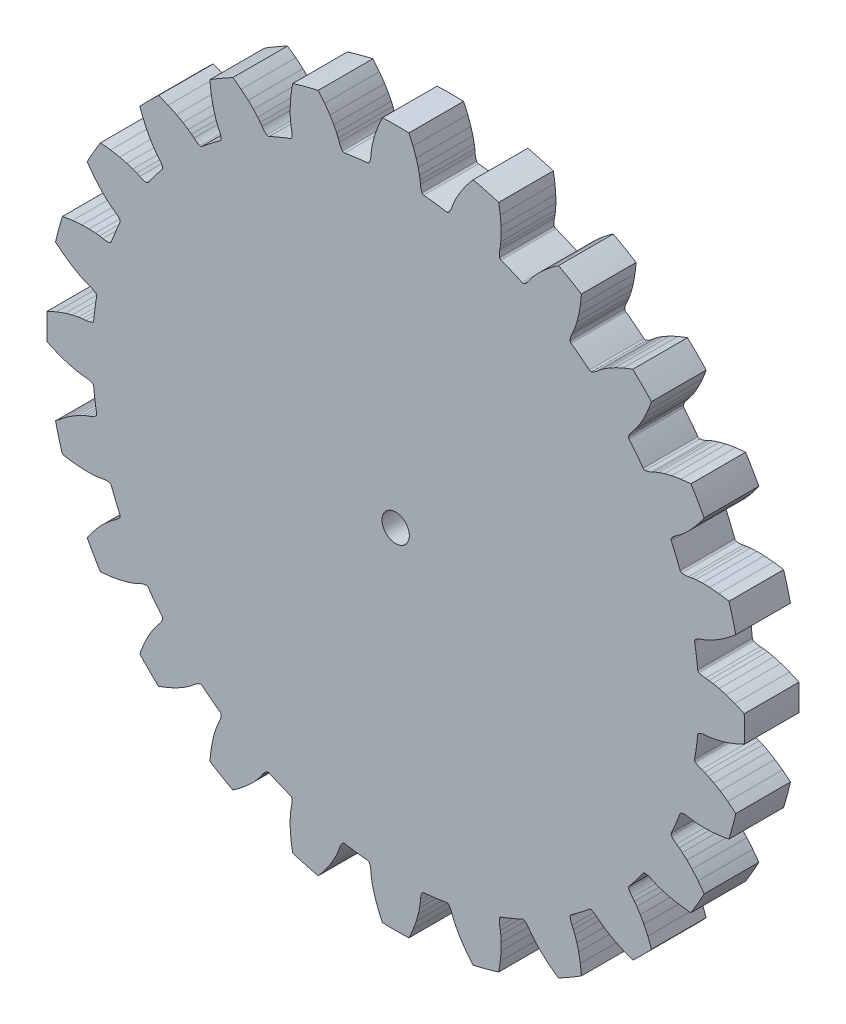
from build123d import *

# Parameters (mm, degrees)
BOSS_EXTRUDE1_DEPTH = 6.35
SKETCH2_R           = 1.5875
CUT_EXTRUDE1_DEPTH  = 58.632651032


with BuildPart() as part:
    # Model → Boss-Extrude1 (new body)
    with BuildSketch(Plane.XY):
        with BuildLine():
            ThreePointArc((34.918122358, -4.597058019), (34.999024317, -3.934019352), (35.067337394, -3.269565647))
            ThreePointArc((35.067337394, -3.269565647), (35.117289307, -3.136889034), (35.227836474, -3.048133181))
            ThreePointArc((35.227836474, -3.048133181), (35.597586296, -2.925959175), (35.983262257, -2.872149586))
            ThreePointArc((35.983262257, -2.872149586), (36.173696873, -2.859616768), (36.363582299, -2.840487209))
            ThreePointArc((36.363582299, -2.840487209), (36.599053851, -2.809299698), (36.833565008, -2.771563378))
            ThreePointArc((36.833565008, -2.771563378), (37.195949989, -2.701153106), (37.555494844, -2.617439436))
            ThreePointArc((37.555494844, -2.617439436), (37.966482977, -2.506715419), (38.373723351, -2.382915857))
            ThreePointArc((38.373723351, -2.382915857), (38.883469202, -2.208794801), (39.386594794, -2.016379586))
            ThreePointArc((39.386594794, -2.016379586), (39.934832511, -1.784794144), (40.475208291, -1.535414057))
            ThreePointArc((40.475208291, -1.535414057), (40.504320541, 0), (40.475208291, 1.535414057))
            ThreePointArc((40.475208291, 1.535414057), (39.934832515, 1.784794142), (39.386594803, 2.016379583))
            ThreePointArc((39.386594803, 2.016379583), (38.883469215, 2.208794797), (38.373723367, 2.382915852))
            ThreePointArc((38.373723367, 2.382915852), (37.966482996, 2.506715414), (37.555494865, 2.617439431))
            ThreePointArc((37.555494865, 2.617439431), (37.195950011, 2.701153102), (36.83356503, 2.771563374))
            ThreePointArc((36.83356503, 2.771563374), (36.599053872, 2.809299694), (36.363582319, 2.840487206))
            ThreePointArc((36.363582319, 2.840487206), (36.173696892, 2.859616766), (35.983262273, 2.872149585))
            ThreePointArc((35.983262273, 2.872149585), (35.597586321, 2.925959167), (35.227836504, 3.048133159))
            ThreePointArc((35.227836504, 3.048133159), (35.117289331, 3.136889003), (35.067337397, 3.269565608))
            ThreePointArc((35.067337397, 3.269565608), (34.91812236, 4.597058), (34.718672707, 5.917936879))
            ThreePointArc((34.718672707, 5.917936879), (34.732583315, 6.059021153), (34.816391973, 6.173364435))
            ThreePointArc((34.816391973, 6.173364435), (35.141921916, 6.38707376), (35.500529341, 6.538870115))
            ThreePointArc((35.500529341, 6.538870115), (35.681231323, 6.600263994), (35.859695466, 6.667887693))
            ThreePointArc((35.859695466, 6.667887693), (36.079071597, 6.758957038), (36.295825102, 6.856103477))
            ThreePointArc((36.295825102, 6.856103477), (36.627638596, 7.017906712), (36.953265565, 7.191824964))
            ThreePointArc((36.953265565, 7.191824964), (37.321592132, 7.405147707), (37.682914442, 7.630130466))
            ThreePointArc((37.682914442, 7.630130466), (38.13022528, 7.930250426), (38.56640656, 8.246327736))
            ThreePointArc((38.56640656, 8.246327736), (39.036024807, 8.611916458), (39.493443412, 8.992658669))
            ThreePointArc((39.493443412, 8.992658669), (39.124169287, 10.483289565), (38.698654612, 11.958850852))
            ThreePointArc((38.698654612, 11.958850852), (38.112147379, 12.059873974), (37.522651691, 12.141673971))
            ThreePointArc((37.522651691, 12.141673971), (36.986868971, 12.197314312), (36.449426446, 12.233570402))
            ThreePointArc((36.449426446, 12.233570402), (36.024020769, 12.247750032), (35.598379235, 12.248329665))
            ThreePointArc((35.598379235, 12.248329665), (35.229418882, 12.236133805), (34.861158351, 12.210352771))
            ThreePointArc((34.861158351, 12.210352771), (34.624871089, 12.186107303), (34.389351112, 12.155287604))
            ThreePointArc((34.389351112, 12.155287604), (34.20098478, 12.124619375), (34.013795331, 12.087437043))
            ThreePointArc((34.013795331, 12.087437043), (33.627334023, 12.039592826), (33.23856217, 12.061905546))
            ThreePointArc((33.23856217, 12.061905546), (33.108810098, 12.119025393), (33.026221003, 12.234252641))
            ThreePointArc((33.026221003, 12.234252641), (32.538510031, 13.477892133), (32.00398785, 14.702141787))
            ThreePointArc((32.00398785, 14.702141787), (31.980909169, 14.842019062), (32.032267897, 14.974157468))
            ThreePointArc((32.032267897, 14.974157468), (32.291393633, 15.264838172), (32.598494018, 15.504276623))
            ThreePointArc((32.598494018, 15.504276623), (32.757148825, 15.610347671), (32.912029648, 15.721857067))
            ThreePointArc((32.912029648, 15.721857067), (33.100360238, 15.86660202), (33.284584698, 16.01653821))
            ThreePointArc((33.284584698, 16.01653821), (33.563214162, 16.258707785), (33.832732305, 16.510978377))
            ThreePointArc((33.832732305, 16.510978377), (34.13329646, 16.812362255), (34.424077188, 17.123196008))
            ThreePointArc((34.424077188, 17.123196008), (34.778469517, 17.528862191), (35.117981453, 17.947061451))
            ThreePointArc((35.117981453, 17.947061451), (35.476976522, 18.421739186), (35.820265632, 18.907896567))
            ThreePointArc((35.820265632, 18.907896567), (35.077770552, 20.252160271), (34.284851575, 21.567311724))
            ThreePointArc((34.284851575, 21.567311724), (33.692182383, 21.513093325), (33.101601876, 21.439533344))
            ThreePointArc((33.101601876, 21.439533344), (32.569674729, 21.354607013), (32.041161348, 21.250527346))
            ThreePointArc((32.041161348, 21.250527346), (31.62658106, 21.154120727), (31.215292889, 21.044516473))
            ThreePointArc((31.215292889, 21.044516473), (30.862061076, 20.937242211), (30.513021341, 20.817026805))
            ThreePointArc((30.513021341, 20.817026805), (30.291060561, 20.732451838), (30.071542458, 20.64172524))
            ThreePointArc((30.071542458, 20.64172524), (29.897532074, 20.56334921), (29.726344447, 20.478985641))
            ThreePointArc((29.726344447, 20.478985641), (29.365434484, 20.33274813), (28.984134754, 20.253679002))
            ThreePointArc((28.984134754, 20.253679002), (28.844020171, 20.275270231), (28.734422225, 20.365195575))
            ThreePointArc((28.734422225, 20.365195575), (27.941452016, 21.440230191), (27.10828411, 22.484420029))
            ThreePointArc((27.10828411, 22.484420029), (27.049788913, 22.613557898), (27.065197699, 22.754486415))
            ThreePointArc((27.065197699, 22.754486415), (27.240260237, 23.10232909), (27.4749252, 23.413092302))
            ThreePointArc((27.4749252, 23.413092302), (27.600720768, 23.556611952), (27.721463399, 23.704407864))
            ThreePointArc((27.721463399, 23.704407864), (27.865914029, 23.892964296), (28.005054851, 24.085472333))
            ThreePointArc((28.005054851, 24.085472333), (28.211512149, 24.391504792), (28.40655425, 24.7049359))
            ThreePointArc((28.40655425, 24.7049359), (28.618873042, 25.073842099), (28.819295962, 25.449344039))
            ThreePointArc((28.819295962, 25.449344039), (29.056618531, 25.932910967), (29.276323945, 26.424732587))
            ThreePointArc((29.276323945, 26.424732587), (29.500230916, 26.976150832), (29.705995944, 27.534592561))
            ThreePointArc((29.705995944, 27.534592561), (28.640879722, 28.640879722), (27.534592561, 29.705995944))
            ThreePointArc((27.534592561, 29.705995944), (26.976150836, 29.500230918), (26.424732596, 29.276323949))
            ThreePointArc((26.424732596, 29.276323949), (25.932910979, 29.056618537), (25.449344054, 28.81929597))
            ThreePointArc((25.449344054, 28.81929597), (25.073842116, 28.618873052), (24.704935918, 28.406554261))
            ThreePointArc((24.704935918, 28.406554261), (24.39150481, 28.211512161), (24.085472352, 28.005054864))
            ThreePointArc((24.085472352, 28.005054864), (23.892964314, 27.865914042), (23.704407881, 27.721463412))
            ThreePointArc((23.704407881, 27.721463412), (23.556611966, 27.60072078), (23.413092315, 27.474925211))
            ThreePointArc((23.413092315, 27.474925211), (23.102329113, 27.24026025), (22.754486452, 27.065197706))
            ThreePointArc((22.754486452, 27.065197706), (22.613557937, 27.049788908), (22.484420059, 27.108284085))
            ThreePointArc((22.484420059, 27.108284085), (21.440230222, 27.941451993), (20.365195606, 28.734422203))
            ThreePointArc((20.365195606, 28.734422203), (20.275270245, 28.844020135), (20.253679006, 28.984134716))
            ThreePointArc((20.253679006, 28.984134716), (20.332748124, 29.365434458), (20.478985633, 29.726344432))
            ThreePointArc((20.478985633, 29.726344432), (20.563349202, 29.897532057), (20.641725231, 30.071542439))
            ThreePointArc((20.641725231, 30.071542439), (20.73245183, 30.29106054), (20.817026797, 30.51302132))
            ThreePointArc((20.817026797, 30.51302132), (20.937242204, 30.862061055), (21.044516467, 31.215292869))
            ThreePointArc((21.044516467, 31.215292869), (21.154120722, 31.626581041), (21.250527343, 32.041161331))
            ThreePointArc((21.250527343, 32.041161331), (21.354607011, 32.569674716), (21.439533342, 33.101601867))
            ThreePointArc((21.439533342, 33.101601867), (21.513093325, 33.692182378), (21.567311724, 34.284851575))
            ThreePointArc((21.567311724, 34.284851575), (20.252160271, 35.077770552), (18.907896567, 35.820265632))
            ThreePointArc((18.907896567, 35.820265632), (18.42173919, 35.476976525), (17.947061459, 35.117981459))
            ThreePointArc((17.947061459, 35.117981459), (17.528862202, 34.778469526), (17.123196021, 34.4240772))
            ThreePointArc((17.123196021, 34.4240772), (16.812362269, 34.133296474), (16.510978392, 33.83273232))
            ThreePointArc((16.510978392, 33.83273232), (16.2587078, 33.563214178), (16.016538225, 33.284584715))
            ThreePointArc((16.016538225, 33.284584715), (15.866602034, 33.100360255), (15.72185708, 32.912029664))
            ThreePointArc((15.72185708, 32.912029664), (15.610347682, 32.75714884), (15.504276633, 32.598494032))
            ThreePointArc((15.504276633, 32.598494032), (15.264838191, 32.291393651), (14.974157502, 32.032267913))
            ThreePointArc((14.974157502, 32.032267913), (14.8420191, 31.980909174), (14.702141823, 32.003987833))
            ThreePointArc((14.702141823, 32.003987833), (13.477892169, 32.538510016), (12.234252678, 33.026220989))
            ThreePointArc((12.234252678, 33.026220989), (12.119025417, 33.108810067), (12.061905559, 33.238562135))
            ThreePointArc((12.061905559, 33.238562135), (12.039592826, 33.627333997), (12.087437039, 34.013795315))
            ThreePointArc((12.087437039, 34.013795315), (12.124619372, 34.200984761), (12.155287601, 34.389351092))
            ThreePointArc((12.155287601, 34.389351092), (12.186107301, 34.624871067), (12.210352769, 34.861158328))
            ThreePointArc((12.210352769, 34.861158328), (12.236133804, 35.22941886), (12.248329664, 35.598379214))
            ThreePointArc((12.248329664, 35.598379214), (12.247750033, 36.02402075), (12.233570403, 36.449426428))
            ThreePointArc((12.233570403, 36.449426428), (12.197314313, 36.986868957), (12.141673972, 37.522651682))
            ThreePointArc((12.141673972, 37.522651682), (12.059873975, 38.112147374), (11.958850852, 38.698654612))
            ThreePointArc((11.958850852, 38.698654612), (10.483289565, 39.124169287), (8.992658669, 39.493443412))
            ThreePointArc((8.992658669, 39.493443412), (8.611916461, 39.03602481), (8.246327742, 38.566406568))
            ThreePointArc((8.246327742, 38.566406568), (7.930250433, 38.130225291), (7.630130476, 37.682914457))
            ThreePointArc((7.630130476, 37.682914457), (7.405147717, 37.321592149), (7.191824974, 36.953265583))
            ThreePointArc((7.191824974, 36.953265583), (7.017906722, 36.627638615), (6.856103487, 36.295825123))
            ThreePointArc((6.856103487, 36.295825123), (6.758957046, 36.079071617), (6.6678877, 35.859695485))
            ThreePointArc((6.6678877, 35.859695485), (6.600264, 35.681231341), (6.53887012, 35.500529357))
            ThreePointArc((6.53887012, 35.500529357), (6.387073773, 35.141921939), (6.173364465, 34.816391997))
            ThreePointArc((6.173364465, 34.816391997), (6.059021189, 34.73258333), (5.917936918, 34.7186727))
            ThreePointArc((5.917936918, 34.7186727), (4.597058039, 34.918122355), (3.269565647, 35.067337394))
            ThreePointArc((3.269565647, 35.067337394), (3.136889034, 35.117289307), (3.048133181, 35.227836474))
            ThreePointArc((3.048133181, 35.227836474), (2.925959175, 35.597586296), (2.872149586, 35.983262257))
            ThreePointArc((2.872149586, 35.983262257), (2.859616768, 36.173696873), (2.840487209, 36.363582299))
            ThreePointArc((2.840487209, 36.363582299), (2.809299698, 36.599053851), (2.771563378, 36.833565008))
            ThreePointArc((2.771563378, 36.833565008), (2.701153106, 37.195949989), (2.617439436, 37.555494844))
            ThreePointArc((2.617439436, 37.555494844), (2.506715419, 37.966482977), (2.382915857, 38.373723351))
            ThreePointArc((2.382915857, 38.373723351), (2.208794801, 38.883469202), (2.016379586, 39.386594794))
            ThreePointArc((2.016379586, 39.386594794), (1.784794144, 39.934832511), (1.535414057, 40.475208291))
            ThreePointArc((1.535414057, 40.475208291), (0, 40.504320541), (-1.535414057, 40.475208291))
            ThreePointArc((-1.535414057, 40.475208291), (-1.784794142, 39.934832515), (-2.016379583, 39.386594803))
            ThreePointArc((-2.016379583, 39.386594803), (-2.208794797, 38.883469215), (-2.382915852, 38.373723367))
            ThreePointArc((-2.382915852, 38.373723367), (-2.506715414, 37.966482996), (-2.617439431, 37.555494865))
            ThreePointArc((-2.617439431, 37.555494865), (-2.701153102, 37.195950011), (-2.771563374, 36.83356503))
            ThreePointArc((-2.771563374, 36.83356503), (-2.809299694, 36.599053872), (-2.840487206, 36.363582319))
            ThreePointArc((-2.840487206, 36.363582319), (-2.859616766, 36.173696892), (-2.872149585, 35.983262273))
            ThreePointArc((-2.872149585, 35.983262273), (-2.925959167, 35.597586321), (-3.048133159, 35.227836504))
            ThreePointArc((-3.048133159, 35.227836504), (-3.136889003, 35.117289331), (-3.269565608, 35.067337397))
            ThreePointArc((-3.269565608, 35.067337397), (-4.597058, 34.91812236), (-5.917936879, 34.718672707))
            ThreePointArc((-5.917936879, 34.718672707), (-6.059021153, 34.732583315), (-6.173364435, 34.816391973))
            ThreePointArc((-6.173364435, 34.816391973), (-6.38707376, 35.141921916), (-6.538870115, 35.500529341))
            ThreePointArc((-6.538870115, 35.500529341), (-6.600263994, 35.681231323), (-6.667887693, 35.859695466))
            ThreePointArc((-6.667887693, 35.859695466), (-6.758957038, 36.079071597), (-6.856103477, 36.295825102))
            ThreePointArc((-6.856103477, 36.295825102), (-7.017906712, 36.627638596), (-7.191824964, 36.953265565))
            ThreePointArc((-7.191824964, 36.953265565), (-7.405147707, 37.321592132), (-7.630130466, 37.682914442))
            ThreePointArc((-7.630130466, 37.682914442), (-7.930250426, 38.13022528), (-8.246327736, 38.56640656))
            ThreePointArc((-8.246327736, 38.56640656), (-8.611916458, 39.036024807), (-8.992658669, 39.493443412))
            ThreePointArc((-8.992658669, 39.493443412), (-10.483289565, 39.124169287), (-11.958850852, 38.698654612))
            ThreePointArc((-11.958850852, 38.698654612), (-12.059873974, 38.112147379), (-12.141673971, 37.522651691))
            ThreePointArc((-12.141673971, 37.522651691), (-12.197314312, 36.986868971), (-12.233570402, 36.449426446))
            ThreePointArc((-12.233570402, 36.449426446), (-12.247750032, 36.024020769), (-12.248329665, 35.598379235))
            ThreePointArc((-12.248329665, 35.598379235), (-12.236133805, 35.229418882), (-12.210352771, 34.861158351))
            ThreePointArc((-12.210352771, 34.861158351), (-12.186107303, 34.624871089), (-12.155287604, 34.389351112))
            ThreePointArc((-12.155287604, 34.389351112), (-12.124619375, 34.20098478), (-12.087437043, 34.013795331))
            ThreePointArc((-12.087437043, 34.013795331), (-12.039592826, 33.627334023), (-12.061905546, 33.23856217))
            ThreePointArc((-12.061905546, 33.23856217), (-12.119025393, 33.108810098), (-12.234252641, 33.026221003))
            ThreePointArc((-12.234252641, 33.026221003), (-13.477892133, 32.538510031), (-14.702141787, 32.00398785))
            ThreePointArc((-14.702141787, 32.00398785), (-14.842019062, 31.980909169), (-14.974157468, 32.032267897))
            ThreePointArc((-14.974157468, 32.032267897), (-15.264838172, 32.291393633), (-15.504276623, 32.598494018))
            ThreePointArc((-15.504276623, 32.598494018), (-15.610347671, 32.757148825), (-15.721857067, 32.912029648))
            ThreePointArc((-15.721857067, 32.912029648), (-15.86660202, 33.100360238), (-16.01653821, 33.284584698))
            ThreePointArc((-16.01653821, 33.284584698), (-16.258707785, 33.563214162), (-16.510978377, 33.832732305))
            ThreePointArc((-16.510978377, 33.832732305), (-16.812362255, 34.13329646), (-17.123196008, 34.424077188))
            ThreePointArc((-17.123196008, 34.424077188), (-17.528862191, 34.778469517), (-17.947061451, 35.117981453))
            ThreePointArc((-17.947061451, 35.117981453), (-18.421739186, 35.476976522), (-18.907896567, 35.820265632))
            ThreePointArc((-18.907896567, 35.820265632), (-20.252160271, 35.077770552), (-21.567311724, 34.284851575))
            ThreePointArc((-21.567311724, 34.284851575), (-21.513093325, 33.692182383), (-21.439533344, 33.101601876))
            ThreePointArc((-21.439533344, 33.101601876), (-21.354607013, 32.569674729), (-21.250527346, 32.041161348))
            ThreePointArc((-21.250527346, 32.041161348), (-21.154120727, 31.62658106), (-21.044516473, 31.215292889))
            ThreePointArc((-21.044516473, 31.215292889), (-20.937242211, 30.862061076), (-20.817026805, 30.513021341))
            ThreePointArc((-20.817026805, 30.513021341), (-20.732451838, 30.291060561), (-20.64172524, 30.071542458))
            ThreePointArc((-20.64172524, 30.071542458), (-20.56334921, 29.897532074), (-20.478985641, 29.726344447))
            ThreePointArc((-20.478985641, 29.726344447), (-20.33274813, 29.365434484), (-20.253679002, 28.984134754))
            ThreePointArc((-20.253679002, 28.984134754), (-20.275270231, 28.844020171), (-20.365195575, 28.734422225))
            ThreePointArc((-20.365195575, 28.734422225), (-21.440230191, 27.941452016), (-22.484420029, 27.10828411))
            ThreePointArc((-22.484420029, 27.10828411), (-22.613557898, 27.049788913), (-22.754486415, 27.065197699))
            ThreePointArc((-22.754486415, 27.065197699), (-23.10232909, 27.240260237), (-23.413092302, 27.4749252))
            ThreePointArc((-23.413092302, 27.4749252), (-23.556611952, 27.600720768), (-23.704407864, 27.721463399))
            ThreePointArc((-23.704407864, 27.721463399), (-23.892964296, 27.865914029), (-24.085472333, 28.005054851))
            ThreePointArc((-24.085472333, 28.005054851), (-24.391504792, 28.211512149), (-24.7049359, 28.40655425))
            ThreePointArc((-24.7049359, 28.40655425), (-25.073842099, 28.618873042), (-25.449344039, 28.819295962))
            ThreePointArc((-25.449344039, 28.819295962), (-25.932910967, 29.056618531), (-26.424732587, 29.276323945))
            ThreePointArc((-26.424732587, 29.276323945), (-26.976150832, 29.500230916), (-27.534592561, 29.705995944))
            ThreePointArc((-27.534592561, 29.705995944), (-28.640879722, 28.640879722), (-29.705995944, 27.534592561))
            ThreePointArc((-29.705995944, 27.534592561), (-29.500230918, 26.976150836), (-29.276323949, 26.424732596))
            ThreePointArc((-29.276323949, 26.424732596), (-29.056618537, 25.932910979), (-28.81929597, 25.449344054))
            ThreePointArc((-28.81929597, 25.449344054), (-28.618873052, 25.073842116), (-28.406554261, 24.704935918))
            ThreePointArc((-28.406554261, 24.704935918), (-28.211512161, 24.39150481), (-28.005054864, 24.085472352))
            ThreePointArc((-28.005054864, 24.085472352), (-27.865914042, 23.892964314), (-27.721463412, 23.704407881))
            ThreePointArc((-27.721463412, 23.704407881), (-27.60072078, 23.556611966), (-27.474925211, 23.413092315))
            ThreePointArc((-27.474925211, 23.413092315), (-27.24026025, 23.102329113), (-27.065197706, 22.754486452))
            ThreePointArc((-27.065197706, 22.754486452), (-27.049788908, 22.613557937), (-27.108284085, 22.484420059))
            ThreePointArc((-27.108284085, 22.484420059), (-27.941451993, 21.440230222), (-28.734422203, 20.365195606))
            ThreePointArc((-28.734422203, 20.365195606), (-28.844020135, 20.275270245), (-28.984134716, 20.253679006))
            ThreePointArc((-28.984134716, 20.253679006), (-29.365434458, 20.332748124), (-29.726344432, 20.478985633))
            ThreePointArc((-29.726344432, 20.478985633), (-29.897532057, 20.563349202), (-30.071542439, 20.641725231))
            ThreePointArc((-30.071542439, 20.641725231), (-30.29106054, 20.73245183), (-30.51302132, 20.817026797))
            ThreePointArc((-30.51302132, 20.817026797), (-30.862061055, 20.937242204), (-31.215292869, 21.044516467))
            ThreePointArc((-31.215292869, 21.044516467), (-31.626581041, 21.154120722), (-32.041161331, 21.250527343))
            ThreePointArc((-32.041161331, 21.250527343), (-32.569674716, 21.354607011), (-33.101601867, 21.439533342))
            ThreePointArc((-33.101601867, 21.439533342), (-33.692182378, 21.513093325), (-34.284851575, 21.567311724))
            ThreePointArc((-34.284851575, 21.567311724), (-35.077770552, 20.252160271), (-35.820265632, 18.907896567))
            ThreePointArc((-35.820265632, 18.907896567), (-35.476976525, 18.42173919), (-35.117981459, 17.947061459))
            ThreePointArc((-35.117981459, 17.947061459), (-34.778469526, 17.528862202), (-34.4240772, 17.123196021))
            ThreePointArc((-34.4240772, 17.123196021), (-34.133296474, 16.812362269), (-33.83273232, 16.510978392))
            ThreePointArc((-33.83273232, 16.510978392), (-33.563214178, 16.2587078), (-33.284584715, 16.016538225))
            ThreePointArc((-33.284584715, 16.016538225), (-33.100360255, 15.866602034), (-32.912029664, 15.72185708))
            ThreePointArc((-32.912029664, 15.72185708), (-32.75714884, 15.610347682), (-32.598494032, 15.504276633))
            ThreePointArc((-32.598494032, 15.504276633), (-32.291393651, 15.264838191), (-32.032267913, 14.974157502))
            ThreePointArc((-32.032267913, 14.974157502), (-31.980909174, 14.8420191), (-32.003987833, 14.702141823))
            ThreePointArc((-32.003987833, 14.702141823), (-32.538510016, 13.477892169), (-33.026220989, 12.234252678))
            ThreePointArc((-33.026220989, 12.234252678), (-33.108810067, 12.119025417), (-33.238562135, 12.061905559))
            ThreePointArc((-33.238562135, 12.061905559), (-33.627333997, 12.039592826), (-34.013795315, 12.087437039))
            ThreePointArc((-34.013795315, 12.087437039), (-34.200984761, 12.124619372), (-34.389351092, 12.155287601))
            ThreePointArc((-34.389351092, 12.155287601), (-34.624871067, 12.186107301), (-34.861158328, 12.210352769))
            ThreePointArc((-34.861158328, 12.210352769), (-35.22941886, 12.236133804), (-35.598379214, 12.248329664))
            ThreePointArc((-35.598379214, 12.248329664), (-36.02402075, 12.247750033), (-36.449426428, 12.233570403))
            ThreePointArc((-36.449426428, 12.233570403), (-36.986868957, 12.197314313), (-37.522651682, 12.141673972))
            ThreePointArc((-37.522651682, 12.141673972), (-38.112147374, 12.059873975), (-38.698654612, 11.958850852))
            ThreePointArc((-38.698654612, 11.958850852), (-39.124169287, 10.483289565), (-39.493443412, 8.992658669))
            ThreePointArc((-39.493443412, 8.992658669), (-39.03602481, 8.611916461), (-38.566406568, 8.246327742))
            ThreePointArc((-38.566406568, 8.246327742), (-38.130225291, 7.930250433), (-37.682914457, 7.630130476))
            ThreePointArc((-37.682914457, 7.630130476), (-37.321592149, 7.405147717), (-36.953265583, 7.191824974))
            ThreePointArc((-36.953265583, 7.191824974), (-36.627638615, 7.017906722), (-36.295825123, 6.856103487))
            ThreePointArc((-36.295825123, 6.856103487), (-36.079071617, 6.758957046), (-35.859695485, 6.6678877))
            ThreePointArc((-35.859695485, 6.6678877), (-35.681231341, 6.600264), (-35.500529357, 6.53887012))
            ThreePointArc((-35.500529357, 6.53887012), (-35.141921939, 6.387073773), (-34.816391997, 6.173364465))
            ThreePointArc((-34.816391997, 6.173364465), (-34.73258333, 6.059021189), (-34.7186727, 5.917936918))
            ThreePointArc((-34.7186727, 5.917936918), (-34.918122355, 4.597058039), (-35.067337394, 3.269565647))
            ThreePointArc((-35.067337394, 3.269565647), (-35.117289307, 3.136889034), (-35.227836474, 3.048133181))
            ThreePointArc((-35.227836474, 3.048133181), (-35.597586296, 2.925959175), (-35.983262257, 2.872149586))
            ThreePointArc((-35.983262257, 2.872149586), (-36.173696873, 2.859616768), (-36.363582299, 2.840487209))
            ThreePointArc((-36.363582299, 2.840487209), (-36.599053851, 2.809299698), (-36.833565008, 2.771563378))
            ThreePointArc((-36.833565008, 2.771563378), (-37.195949989, 2.701153106), (-37.555494844, 2.617439436))
            ThreePointArc((-37.555494844, 2.617439436), (-37.966482977, 2.506715419), (-38.373723351, 2.382915857))
            ThreePointArc((-38.373723351, 2.382915857), (-38.883469202, 2.208794801), (-39.386594794, 2.016379586))
            ThreePointArc((-39.386594794, 2.016379586), (-39.934832511, 1.784794144), (-40.475208291, 1.535414057))
            ThreePointArc((-40.475208291, 1.535414057), (-40.504320541, 0), (-40.475208291, -1.535414057))
            ThreePointArc((-40.475208291, -1.535414057), (-39.934832515, -1.784794142), (-39.386594803, -2.016379583))
            ThreePointArc((-39.386594803, -2.016379583), (-38.883469215, -2.208794797), (-38.373723367, -2.382915852))
            ThreePointArc((-38.373723367, -2.382915852), (-37.966482996, -2.506715414), (-37.555494865, -2.617439431))
            ThreePointArc((-37.555494865, -2.617439431), (-37.195950011, -2.701153102), (-36.83356503, -2.771563374))
            ThreePointArc((-36.83356503, -2.771563374), (-36.599053872, -2.809299694), (-36.363582319, -2.840487206))
            ThreePointArc((-36.363582319, -2.840487206), (-36.173696892, -2.859616766), (-35.983262273, -2.872149585))
            ThreePointArc((-35.983262273, -2.872149585), (-35.597586321, -2.925959167), (-35.227836504, -3.048133159))
            ThreePointArc((-35.227836504, -3.048133159), (-35.117289331, -3.136889003), (-35.067337397, -3.269565608))
            ThreePointArc((-35.067337397, -3.269565608), (-34.91812236, -4.597058), (-34.718672707, -5.917936879))
            ThreePointArc((-34.718672707, -5.917936879), (-34.732583315, -6.059021153), (-34.816391973, -6.173364435))
            ThreePointArc((-34.816391973, -6.173364435), (-35.141921916, -6.38707376), (-35.500529341, -6.538870115))
            ThreePointArc((-35.500529341, -6.538870115), (-35.681231323, -6.600263994), (-35.859695466, -6.667887693))
            ThreePointArc((-35.859695466, -6.667887693), (-36.079071597, -6.758957038), (-36.295825102, -6.856103477))
            ThreePointArc((-36.295825102, -6.856103477), (-36.627638596, -7.017906712), (-36.953265565, -7.191824964))
            ThreePointArc((-36.953265565, -7.191824964), (-37.321592132, -7.405147707), (-37.682914442, -7.630130466))
            ThreePointArc((-37.682914442, -7.630130466), (-38.13022528, -7.930250426), (-38.56640656, -8.246327736))
            ThreePointArc((-38.56640656, -8.246327736), (-39.036024807, -8.611916458), (-39.493443412, -8.992658669))
            ThreePointArc((-39.493443412, -8.992658669), (-39.124169287, -10.483289565), (-38.698654612, -11.958850852))
            ThreePointArc((-38.698654612, -11.958850852), (-38.112147379, -12.059873974), (-37.522651691, -12.141673971))
            ThreePointArc((-37.522651691, -12.141673971), (-36.986868971, -12.197314312), (-36.449426446, -12.233570402))
            ThreePointArc((-36.449426446, -12.233570402), (-36.024020769, -12.247750032), (-35.598379235, -12.248329665))
            ThreePointArc((-35.598379235, -12.248329665), (-35.229418882, -12.236133805), (-34.861158351, -12.210352771))
            ThreePointArc((-34.861158351, -12.210352771), (-34.624871089, -12.186107303), (-34.389351112, -12.155287604))
            ThreePointArc((-34.389351112, -12.155287604), (-34.20098478, -12.124619375), (-34.013795331, -12.087437043))
            ThreePointArc((-34.013795331, -12.087437043), (-33.627334023, -12.039592826), (-33.23856217, -12.061905546))
            ThreePointArc((-33.23856217, -12.061905546), (-33.108810098, -12.119025393), (-33.026221003, -12.234252641))
            ThreePointArc((-33.026221003, -12.234252641), (-32.538510031, -13.477892133), (-32.00398785, -14.702141787))
            ThreePointArc((-32.00398785, -14.702141787), (-31.980909169, -14.842019062), (-32.032267897, -14.974157468))
            ThreePointArc((-32.032267897, -14.974157468), (-32.291393633, -15.264838172), (-32.598494018, -15.504276623))
            ThreePointArc((-32.598494018, -15.504276623), (-32.757148825, -15.610347671), (-32.912029648, -15.721857067))
            ThreePointArc((-32.912029648, -15.721857067), (-33.100360238, -15.86660202), (-33.284584698, -16.01653821))
            ThreePointArc((-33.284584698, -16.01653821), (-33.563214162, -16.258707785), (-33.832732305, -16.510978377))
            ThreePointArc((-33.832732305, -16.510978377), (-34.13329646, -16.812362255), (-34.424077188, -17.123196008))
            ThreePointArc((-34.424077188, -17.123196008), (-34.778469517, -17.528862191), (-35.117981453, -17.947061451))
            ThreePointArc((-35.117981453, -17.947061451), (-35.476976522, -18.421739186), (-35.820265632, -18.907896567))
            ThreePointArc((-35.820265632, -18.907896567), (-35.077770552, -20.252160271), (-34.284851575, -21.567311724))
            ThreePointArc((-34.284851575, -21.567311724), (-33.692182383, -21.513093325), (-33.101601876, -21.439533344))
            ThreePointArc((-33.101601876, -21.439533344), (-32.569674729, -21.354607013), (-32.041161348, -21.250527346))
            ThreePointArc((-32.041161348, -21.250527346), (-31.62658106, -21.154120727), (-31.215292889, -21.044516473))
            ThreePointArc((-31.215292889, -21.044516473), (-30.862061076, -20.937242211), (-30.513021341, -20.817026805))
            ThreePointArc((-30.513021341, -20.817026805), (-30.291060561, -20.732451838), (-30.071542458, -20.64172524))
            ThreePointArc((-30.071542458, -20.64172524), (-29.897532074, -20.56334921), (-29.726344447, -20.478985641))
            ThreePointArc((-29.726344447, -20.478985641), (-29.365434484, -20.33274813), (-28.984134754, -20.253679002))
            ThreePointArc((-28.984134754, -20.253679002), (-28.844020171, -20.275270231), (-28.734422225, -20.365195575))
            ThreePointArc((-28.734422225, -20.365195575), (-27.941452016, -21.440230191), (-27.10828411, -22.484420029))
            ThreePointArc((-27.10828411, -22.484420029), (-27.049788913, -22.613557898), (-27.065197699, -22.754486415))
            ThreePointArc((-27.065197699, -22.754486415), (-27.240260237, -23.10232909), (-27.4749252, -23.413092302))
            ThreePointArc((-27.4749252, -23.413092302), (-27.600720768, -23.556611952), (-27.721463399, -23.704407864))
            ThreePointArc((-27.721463399, -23.704407864), (-27.865914029, -23.892964296), (-28.005054851, -24.085472333))
            ThreePointArc((-28.005054851, -24.085472333), (-28.211512149, -24.391504792), (-28.40655425, -24.7049359))
            ThreePointArc((-28.40655425, -24.7049359), (-28.618873042, -25.073842099), (-28.819295962, -25.449344039))
            ThreePointArc((-28.819295962, -25.449344039), (-29.056618531, -25.932910967), (-29.276323945, -26.424732587))
            ThreePointArc((-29.276323945, -26.424732587), (-29.500230916, -26.976150832), (-29.705995944, -27.534592561))
            ThreePointArc((-29.705995944, -27.534592561), (-28.640879722, -28.640879722), (-27.534592561, -29.705995944))
            ThreePointArc((-27.534592561, -29.705995944), (-26.976150836, -29.500230918), (-26.424732596, -29.276323949))
            ThreePointArc((-26.424732596, -29.276323949), (-25.932910979, -29.056618537), (-25.449344054, -28.81929597))
            ThreePointArc((-25.449344054, -28.81929597), (-25.073842116, -28.618873052), (-24.704935918, -28.406554261))
            ThreePointArc((-24.704935918, -28.406554261), (-24.39150481, -28.211512161), (-24.085472352, -28.005054864))
            ThreePointArc((-24.085472352, -28.005054864), (-23.892964314, -27.865914042), (-23.704407881, -27.721463412))
            ThreePointArc((-23.704407881, -27.721463412), (-23.556611966, -27.60072078), (-23.413092315, -27.474925211))
            ThreePointArc((-23.413092315, -27.474925211), (-23.102329113, -27.24026025), (-22.754486452, -27.065197706))
            ThreePointArc((-22.754486452, -27.065197706), (-22.613557937, -27.049788908), (-22.484420059, -27.108284085))
            ThreePointArc((-22.484420059, -27.108284085), (-21.440230222, -27.941451993), (-20.365195606, -28.734422203))
            ThreePointArc((-20.365195606, -28.734422203), (-20.275270245, -28.844020135), (-20.253679006, -28.984134716))
            ThreePointArc((-20.253679006, -28.984134716), (-20.332748124, -29.365434458), (-20.478985633, -29.726344432))
            ThreePointArc((-20.478985633, -29.726344432), (-20.563349202, -29.897532057), (-20.641725231, -30.071542439))
            ThreePointArc((-20.641725231, -30.071542439), (-20.73245183, -30.29106054), (-20.817026797, -30.51302132))
            ThreePointArc((-20.817026797, -30.51302132), (-20.937242204, -30.862061055), (-21.044516467, -31.215292869))
            ThreePointArc((-21.044516467, -31.215292869), (-21.154120722, -31.626581041), (-21.250527343, -32.041161331))
            ThreePointArc((-21.250527343, -32.041161331), (-21.354607011, -32.569674716), (-21.439533342, -33.101601867))
            ThreePointArc((-21.439533342, -33.101601867), (-21.513093325, -33.692182378), (-21.567311724, -34.284851575))
            ThreePointArc((-21.567311724, -34.284851575), (-20.252160271, -35.077770552), (-18.907896567, -35.820265632))
            ThreePointArc((-18.907896567, -35.820265632), (-18.42173919, -35.476976525), (-17.947061459, -35.117981459))
            ThreePointArc((-17.947061459, -35.117981459), (-17.528862202, -34.778469526), (-17.123196021, -34.4240772))
            ThreePointArc((-17.123196021, -34.4240772), (-16.812362269, -34.133296474), (-16.510978392, -33.83273232))
            ThreePointArc((-16.510978392, -33.83273232), (-16.2587078, -33.563214178), (-16.016538225, -33.284584715))
            ThreePointArc((-16.016538225, -33.284584715), (-15.866602034, -33.100360255), (-15.72185708, -32.912029664))
            ThreePointArc((-15.72185708, -32.912029664), (-15.610347682, -32.75714884), (-15.504276633, -32.598494032))
            ThreePointArc((-15.504276633, -32.598494032), (-15.264838191, -32.291393651), (-14.974157502, -32.032267913))
            ThreePointArc((-14.974157502, -32.032267913), (-14.8420191, -31.980909174), (-14.702141823, -32.003987833))
            ThreePointArc((-14.702141823, -32.003987833), (-13.477892169, -32.538510016), (-12.234252678, -33.026220989))
            ThreePointArc((-12.234252678, -33.026220989), (-12.119025417, -33.108810067), (-12.061905559, -33.238562135))
            ThreePointArc((-12.061905559, -33.238562135), (-12.039592826, -33.627333997), (-12.087437039, -34.013795315))
            ThreePointArc((-12.087437039, -34.013795315), (-12.124619372, -34.200984761), (-12.155287601, -34.389351092))
            ThreePointArc((-12.155287601, -34.389351092), (-12.186107301, -34.624871067), (-12.210352769, -34.861158328))
            ThreePointArc((-12.210352769, -34.861158328), (-12.236133804, -35.22941886), (-12.248329664, -35.598379214))
            ThreePointArc((-12.248329664, -35.598379214), (-12.247750033, -36.02402075), (-12.233570403, -36.449426428))
            ThreePointArc((-12.233570403, -36.449426428), (-12.197314313, -36.986868957), (-12.141673972, -37.522651682))
            ThreePointArc((-12.141673972, -37.522651682), (-12.059873975, -38.112147374), (-11.958850852, -38.698654612))
            ThreePointArc((-11.958850852, -38.698654612), (-10.483289565, -39.124169287), (-8.992658669, -39.493443412))
            ThreePointArc((-8.992658669, -39.493443412), (-8.611916461, -39.03602481), (-8.246327742, -38.566406568))
            ThreePointArc((-8.246327742, -38.566406568), (-7.930250433, -38.130225291), (-7.630130476, -37.682914457))
            ThreePointArc((-7.630130476, -37.682914457), (-7.405147717, -37.321592149), (-7.191824974, -36.953265583))
            ThreePointArc((-7.191824974, -36.953265583), (-7.017906722, -36.627638615), (-6.856103487, -36.295825123))
            ThreePointArc((-6.856103487, -36.295825123), (-6.758957046, -36.079071617), (-6.6678877, -35.859695485))
            ThreePointArc((-6.6678877, -35.859695485), (-6.600264, -35.681231341), (-6.53887012, -35.500529357))
            ThreePointArc((-6.53887012, -35.500529357), (-6.387073773, -35.141921939), (-6.173364465, -34.816391997))
            ThreePointArc((-6.173364465, -34.816391997), (-6.059021189, -34.73258333), (-5.917936918, -34.7186727))
            ThreePointArc((-5.917936918, -34.7186727), (-4.597058039, -34.918122355), (-3.269565647, -35.067337394))
            ThreePointArc((-3.269565647, -35.067337394), (-3.136889034, -35.117289307), (-3.048133181, -35.227836474))
            ThreePointArc((-3.048133181, -35.227836474), (-2.925959175, -35.597586296), (-2.872149586, -35.983262257))
            ThreePointArc((-2.872149586, -35.983262257), (-2.859616768, -36.173696873), (-2.840487209, -36.363582299))
            ThreePointArc((-2.840487209, -36.363582299), (-2.809299698, -36.599053851), (-2.771563378, -36.833565008))
            ThreePointArc((-2.771563378, -36.833565008), (-2.701153106, -37.195949989), (-2.617439436, -37.555494844))
            ThreePointArc((-2.617439436, -37.555494844), (-2.506715419, -37.966482977), (-2.382915857, -38.373723351))
            ThreePointArc((-2.382915857, -38.373723351), (-2.208794801, -38.883469202), (-2.016379586, -39.386594794))
            ThreePointArc((-2.016379586, -39.386594794), (-1.784794144, -39.934832511), (-1.535414057, -40.475208291))
            ThreePointArc((-1.535414057, -40.475208291), (0, -40.504320541), (1.535414057, -40.475208291))
            ThreePointArc((1.535414057, -40.475208291), (1.784794142, -39.934832515), (2.016379583, -39.386594803))
            ThreePointArc((2.016379583, -39.386594803), (2.208794797, -38.883469215), (2.382915852, -38.373723367))
            ThreePointArc((2.382915852, -38.373723367), (2.506715414, -37.966482996), (2.617439431, -37.555494865))
            ThreePointArc((2.617439431, -37.555494865), (2.701153102, -37.195950011), (2.771563374, -36.83356503))
            ThreePointArc((2.771563374, -36.83356503), (2.809299694, -36.599053872), (2.840487206, -36.363582319))
            ThreePointArc((2.840487206, -36.363582319), (2.859616766, -36.173696892), (2.872149585, -35.983262273))
            ThreePointArc((2.872149585, -35.983262273), (2.925959167, -35.597586321), (3.048133159, -35.227836504))
            ThreePointArc((3.048133159, -35.227836504), (3.136889003, -35.117289331), (3.269565608, -35.067337397))
            ThreePointArc((3.269565608, -35.067337397), (4.597058, -34.91812236), (5.917936879, -34.718672707))
            ThreePointArc((5.917936879, -34.718672707), (6.059021153, -34.732583315), (6.173364435, -34.816391973))
            ThreePointArc((6.173364435, -34.816391973), (6.38707376, -35.141921916), (6.538870115, -35.500529341))
            ThreePointArc((6.538870115, -35.500529341), (6.600263994, -35.681231323), (6.667887693, -35.859695466))
            ThreePointArc((6.667887693, -35.859695466), (6.758957038, -36.079071597), (6.856103477, -36.295825102))
            ThreePointArc((6.856103477, -36.295825102), (7.017906712, -36.627638596), (7.191824964, -36.953265565))
            ThreePointArc((7.191824964, -36.953265565), (7.405147707, -37.321592132), (7.630130466, -37.682914442))
            ThreePointArc((7.630130466, -37.682914442), (7.930250426, -38.13022528), (8.246327736, -38.56640656))
            ThreePointArc((8.246327736, -38.56640656), (8.611916458, -39.036024807), (8.992658669, -39.493443412))
            ThreePointArc((8.992658669, -39.493443412), (10.483289565, -39.124169287), (11.958850852, -38.698654612))
            ThreePointArc((11.958850852, -38.698654612), (12.059873974, -38.112147379), (12.141673971, -37.522651691))
            ThreePointArc((12.141673971, -37.522651691), (12.197314312, -36.986868971), (12.233570402, -36.449426446))
            ThreePointArc((12.233570402, -36.449426446), (12.247750032, -36.024020769), (12.248329665, -35.598379235))
            ThreePointArc((12.248329665, -35.598379235), (12.236133805, -35.229418882), (12.210352771, -34.861158351))
            ThreePointArc((12.210352771, -34.861158351), (12.186107303, -34.624871089), (12.155287604, -34.389351112))
            ThreePointArc((12.155287604, -34.389351112), (12.124619375, -34.20098478), (12.087437043, -34.013795331))
            ThreePointArc((12.087437043, -34.013795331), (12.039592826, -33.627334023), (12.061905546, -33.23856217))
            ThreePointArc((12.061905546, -33.23856217), (12.119025393, -33.108810098), (12.234252641, -33.026221003))
            ThreePointArc((12.234252641, -33.026221003), (13.477892133, -32.538510031), (14.702141787, -32.00398785))
            ThreePointArc((14.702141787, -32.00398785), (14.842019062, -31.980909169), (14.974157468, -32.032267897))
            ThreePointArc((14.974157468, -32.032267897), (15.264838172, -32.291393633), (15.504276623, -32.598494018))
            ThreePointArc((15.504276623, -32.598494018), (15.610347671, -32.757148825), (15.721857067, -32.912029648))
            ThreePointArc((15.721857067, -32.912029648), (15.86660202, -33.100360238), (16.01653821, -33.284584698))
            ThreePointArc((16.01653821, -33.284584698), (16.258707785, -33.563214162), (16.510978377, -33.832732305))
            ThreePointArc((16.510978377, -33.832732305), (16.812362255, -34.13329646), (17.123196008, -34.424077188))
            ThreePointArc((17.123196008, -34.424077188), (17.528862191, -34.778469517), (17.947061451, -35.117981453))
            ThreePointArc((17.947061451, -35.117981453), (18.421739186, -35.476976522), (18.907896567, -35.820265632))
            ThreePointArc((18.907896567, -35.820265632), (20.252160271, -35.077770552), (21.567311724, -34.284851575))
            ThreePointArc((21.567311724, -34.284851575), (21.513093325, -33.692182383), (21.439533344, -33.101601876))
            ThreePointArc((21.439533344, -33.101601876), (21.354607013, -32.569674729), (21.250527346, -32.041161348))
            ThreePointArc((21.250527346, -32.041161348), (21.154120727, -31.62658106), (21.044516473, -31.215292889))
            ThreePointArc((21.044516473, -31.215292889), (20.937242211, -30.862061076), (20.817026805, -30.513021341))
            ThreePointArc((20.817026805, -30.513021341), (20.732451838, -30.291060561), (20.64172524, -30.071542458))
            ThreePointArc((20.64172524, -30.071542458), (20.56334921, -29.897532074), (20.478985641, -29.726344447))
            ThreePointArc((20.478985641, -29.726344447), (20.33274813, -29.365434484), (20.253679002, -28.984134754))
            ThreePointArc((20.253679002, -28.984134754), (20.275270231, -28.844020171), (20.365195575, -28.734422225))
            ThreePointArc((20.365195575, -28.734422225), (21.440230191, -27.941452016), (22.484420029, -27.10828411))
            ThreePointArc((22.484420029, -27.10828411), (22.613557898, -27.049788913), (22.754486415, -27.065197699))
            ThreePointArc((22.754486415, -27.065197699), (23.10232909, -27.240260237), (23.413092302, -27.4749252))
            ThreePointArc((23.413092302, -27.4749252), (23.556611952, -27.600720768), (23.704407864, -27.721463399))
            ThreePointArc((23.704407864, -27.721463399), (23.892964296, -27.865914029), (24.085472333, -28.005054851))
            ThreePointArc((24.085472333, -28.005054851), (24.391504792, -28.211512149), (24.7049359, -28.40655425))
            ThreePointArc((24.7049359, -28.40655425), (25.073842099, -28.618873042), (25.449344039, -28.819295962))
            ThreePointArc((25.449344039, -28.819295962), (25.932910967, -29.056618531), (26.424732587, -29.276323945))
            ThreePointArc((26.424732587, -29.276323945), (26.976150832, -29.500230916), (27.534592561, -29.705995944))
            ThreePointArc((27.534592561, -29.705995944), (28.640879722, -28.640879722), (29.705995944, -27.534592561))
            ThreePointArc((29.705995944, -27.534592561), (29.500230918, -26.976150836), (29.276323949, -26.424732596))
            ThreePointArc((29.276323949, -26.424732596), (29.056618537, -25.932910979), (28.81929597, -25.449344054))
            ThreePointArc((28.81929597, -25.449344054), (28.618873052, -25.073842116), (28.406554261, -24.704935918))
            ThreePointArc((28.406554261, -24.704935918), (28.211512161, -24.39150481), (28.005054864, -24.085472352))
            ThreePointArc((28.005054864, -24.085472352), (27.865914042, -23.892964314), (27.721463412, -23.704407881))
            ThreePointArc((27.721463412, -23.704407881), (27.60072078, -23.556611966), (27.474925211, -23.413092315))
            ThreePointArc((27.474925211, -23.413092315), (27.24026025, -23.102329113), (27.065197706, -22.754486452))
            ThreePointArc((27.065197706, -22.754486452), (27.049788908, -22.613557937), (27.108284085, -22.484420059))
            ThreePointArc((27.108284085, -22.484420059), (27.941451993, -21.440230222), (28.734422203, -20.365195606))
            ThreePointArc((28.734422203, -20.365195606), (28.844020135, -20.275270245), (28.984134716, -20.253679006))
            ThreePointArc((28.984134716, -20.253679006), (29.365434458, -20.332748124), (29.726344432, -20.478985633))
            ThreePointArc((29.726344432, -20.478985633), (29.897532057, -20.563349202), (30.071542439, -20.641725231))
            ThreePointArc((30.071542439, -20.641725231), (30.29106054, -20.73245183), (30.51302132, -20.817026797))
            ThreePointArc((30.51302132, -20.817026797), (30.862061055, -20.937242204), (31.215292869, -21.044516467))
            ThreePointArc((31.215292869, -21.044516467), (31.626581041, -21.154120722), (32.041161331, -21.250527343))
            ThreePointArc((32.041161331, -21.250527343), (32.569674716, -21.354607011), (33.101601867, -21.439533342))
            ThreePointArc((33.101601867, -21.439533342), (33.692182378, -21.513093325), (34.284851575, -21.567311724))
            ThreePointArc((34.284851575, -21.567311724), (35.077770552, -20.252160271), (35.820265632, -18.907896567))
            ThreePointArc((35.820265632, -18.907896567), (35.476976525, -18.42173919), (35.117981459, -17.947061459))
            ThreePointArc((35.117981459, -17.947061459), (34.778469526, -17.528862202), (34.4240772, -17.123196021))
            ThreePointArc((34.4240772, -17.123196021), (34.133296474, -16.812362269), (33.83273232, -16.510978392))
            ThreePointArc((33.83273232, -16.510978392), (33.563214178, -16.2587078), (33.284584715, -16.016538225))
            ThreePointArc((33.284584715, -16.016538225), (33.100360255, -15.866602034), (32.912029664, -15.72185708))
            ThreePointArc((32.912029664, -15.72185708), (32.75714884, -15.610347682), (32.598494032, -15.504276633))
            ThreePointArc((32.598494032, -15.504276633), (32.291393651, -15.264838191), (32.032267913, -14.974157502))
            ThreePointArc((32.032267913, -14.974157502), (31.980909174, -14.8420191), (32.003987833, -14.702141823))
            ThreePointArc((32.003987833, -14.702141823), (32.538510016, -13.477892169), (33.026220989, -12.234252678))
            ThreePointArc((33.026220989, -12.234252678), (33.108810067, -12.119025417), (33.238562135, -12.061905559))
            ThreePointArc((33.238562135, -12.061905559), (33.627333997, -12.039592826), (34.013795315, -12.087437039))
            ThreePointArc((34.013795315, -12.087437039), (34.200984761, -12.124619372), (34.389351092, -12.155287601))
            ThreePointArc((34.389351092, -12.155287601), (34.624871067, -12.186107301), (34.861158328, -12.210352769))
            ThreePointArc((34.861158328, -12.210352769), (35.22941886, -12.236133804), (35.598379214, -12.248329664))
            ThreePointArc((35.598379214, -12.248329664), (36.02402075, -12.247750033), (36.449426428, -12.233570403))
            ThreePointArc((36.449426428, -12.233570403), (36.986868957, -12.197314313), (37.522651682, -12.141673972))
            ThreePointArc((37.522651682, -12.141673972), (38.112147374, -12.059873975), (38.698654612, -11.958850852))
            ThreePointArc((38.698654612, -11.958850852), (39.124169287, -10.483289565), (39.493443412, -8.992658669))
            ThreePointArc((39.493443412, -8.992658669), (39.03602481, -8.611916461), (38.566406568, -8.246327742))
            ThreePointArc((38.566406568, -8.246327742), (38.130225291, -7.930250433), (37.682914457, -7.630130476))
            ThreePointArc((37.682914457, -7.630130476), (37.321592149, -7.405147717), (36.953265583, -7.191824974))
            ThreePointArc((36.953265583, -7.191824974), (36.627638615, -7.017906722), (36.295825123, -6.856103487))
            ThreePointArc((36.295825123, -6.856103487), (36.079071617, -6.758957046), (35.859695485, -6.6678877))
            ThreePointArc((35.859695485, -6.6678877), (35.681231341, -6.600264), (35.500529357, -6.53887012))
            ThreePointArc((35.500529357, -6.53887012), (35.141921939, -6.387073773), (34.816391997, -6.173364465))
            ThreePointArc((34.816391997, -6.173364465), (34.73258333, -6.059021189), (34.7186727, -5.917936918))
            ThreePointArc((34.7186727, -5.917936918), (34.824660612, -5.25844318), (34.918122358, -4.597058019))
        make_face()
    extrude(amount=BOSS_EXTRUDE1_DEPTH)

    # Sketch2 → Cut-Extrude1 (cut, through all)
    with BuildSketch(Plane.XY.offset(6.35)):
        Circle(SKETCH2_R)
    extrude(amount=-CUT_EXTRUDE1_DEPTH, mode=Mode.SUBTRACT)


solid = part.part
